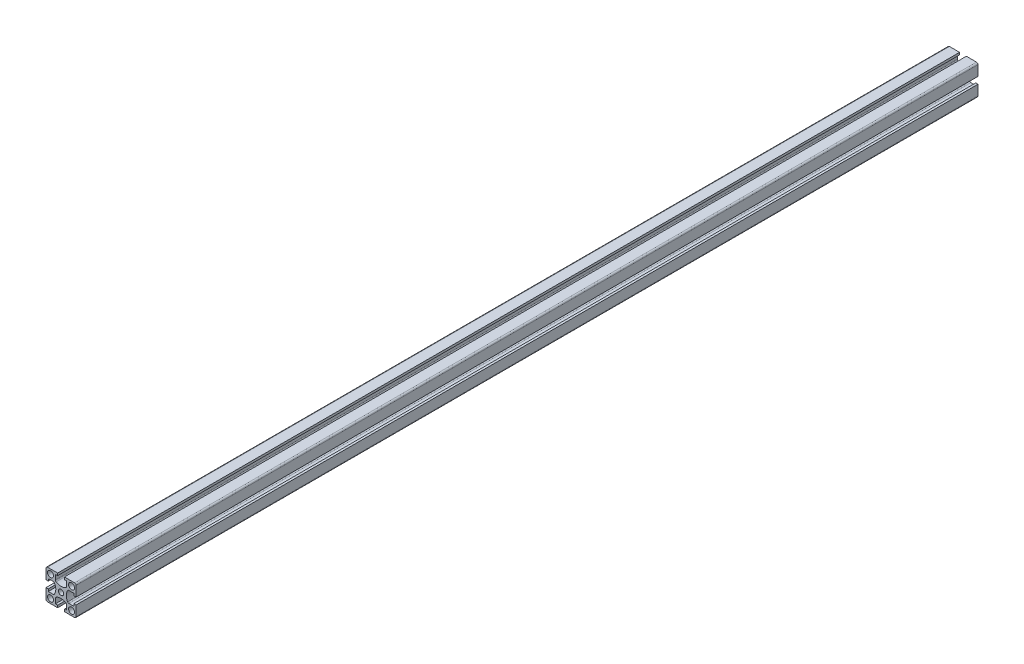
from build123d import *

# Parameters (mm, degrees)
SKETCH1_R           = 2
SKETCH1_R_2         = 1.75
BOSS_EXTRUDE1_DEPTH = 600


with BuildPart() as part:
    # Sketch1 → Boss-Extrude1 (new body)
    with BuildSketch(Plane.XY):
        with BuildLine():
            Line((-10, 9), (-10, 2.25))
            Line((-10, 2.25), (-8.5, 2.25))
            Line((-8.5, 2.25), (-8.5, 3.75))
            Line((-8.5, 3.75), (-5.236860279, 3.75))
            ThreePointArc((-5.236860279, 3.75), (-4.736860279, 3.616025404), (-4.370834875, 3.25))
            ThreePointArc((-4.370834875, 3.25), (-3.5, 0), (-4.370834875, -3.25))
            ThreePointArc((-4.370834875, -3.25), (-4.736860279, -3.616025404), (-5.236860279, -3.75))
            Line((-5.236860279, -3.75), (-8.5, -3.75))
            Line((-8.5, -3.75), (-8.5, -2.25))
            Line((-8.5, -2.25), (-10, -2.25))
            Line((-10, -2.25), (-10, -9))
            ThreePointArc((-10, -9), (-9.707106781, -9.707106781), (-9, -10))
            Line((-9, -10), (-2.25, -10))
            Line((-2.25, -10), (-2.25, -8.5))
            Line((-2.25, -8.5), (-3.75, -8.5))
            Line((-3.75, -8.5), (-3.75, -5.236860279))
            ThreePointArc((-3.75, -5.236860279), (-3.616025404, -4.736860279), (-3.25, -4.370834875))
            ThreePointArc((-3.25, -4.370834875), (0, -3.5), (3.25, -4.370834875))
            ThreePointArc((3.25, -4.370834875), (3.616025404, -4.736860279), (3.75, -5.236860279))
            Line((3.75, -5.236860279), (3.75, -8.5))
            Line((3.75, -8.5), (2.25, -8.5))
            Line((2.25, -8.5), (2.25, -10))
            Line((2.25, -10), (9, -10))
            ThreePointArc((9, -10), (9.707106781, -9.707106781), (10, -9))
            Line((10, -9), (10, -2.25))
            Line((10, -2.25), (8.5, -2.25))
            Line((8.5, -2.25), (8.5, -3.75))
            Line((8.5, -3.75), (5.236860279, -3.75))
            ThreePointArc((5.236860279, -3.75), (4.736860279, -3.616025404), (4.370834875, -3.25))
            ThreePointArc((4.370834875, -3.25), (3.5, 0), (4.370834875, 3.25))
            ThreePointArc((4.370834875, 3.25), (4.736860279, 3.616025404), (5.236860279, 3.75))
            Line((5.236860279, 3.75), (8.5, 3.75))
            Line((8.5, 3.75), (8.5, 2.25))
            Line((8.5, 2.25), (10, 2.25))
            Line((10, 2.25), (10, 9))
            ThreePointArc((10, 9), (9.707106781, 9.707106781), (9, 10))
            Line((9, 10), (2.25, 10))
            Line((2.25, 10), (2.25, 8.5))
            Line((2.25, 8.5), (3.75, 8.5))
            Line((3.75, 8.5), (3.75, 5.236860279))
            ThreePointArc((3.75, 5.236860279), (3.616025404, 4.736860279), (3.25, 4.370834875))
            ThreePointArc((3.25, 4.370834875), (0, 3.5), (-3.25, 4.370834875))
            ThreePointArc((-3.25, 4.370834875), (-3.616025404, 4.736860279), (-3.75, 5.236860279))
            Line((-3.75, 5.236860279), (-3.75, 8.5))
            Line((-3.75, 8.5), (-2.25, 8.5))
            Line((-2.25, 8.5), (-2.25, 10))
            Line((-2.25, 10), (-9, 10))
            ThreePointArc((-9, 10), (-9.707106781, 9.707106781), (-10, 9))
        make_face()
        with Locations((-7, -7)):
            Circle(SKETCH1_R, mode=Mode.SUBTRACT)
        with Locations((7, -7)):
            Circle(SKETCH1_R, mode=Mode.SUBTRACT)
        with Locations((7, 7)):
            Circle(SKETCH1_R, mode=Mode.SUBTRACT)
        Circle(SKETCH1_R_2, mode=Mode.SUBTRACT)
        with Locations((-7, 7)):
            Circle(SKETCH1_R, mode=Mode.SUBTRACT)
    extrude(amount=BOSS_EXTRUDE1_DEPTH)


solid = part.part
